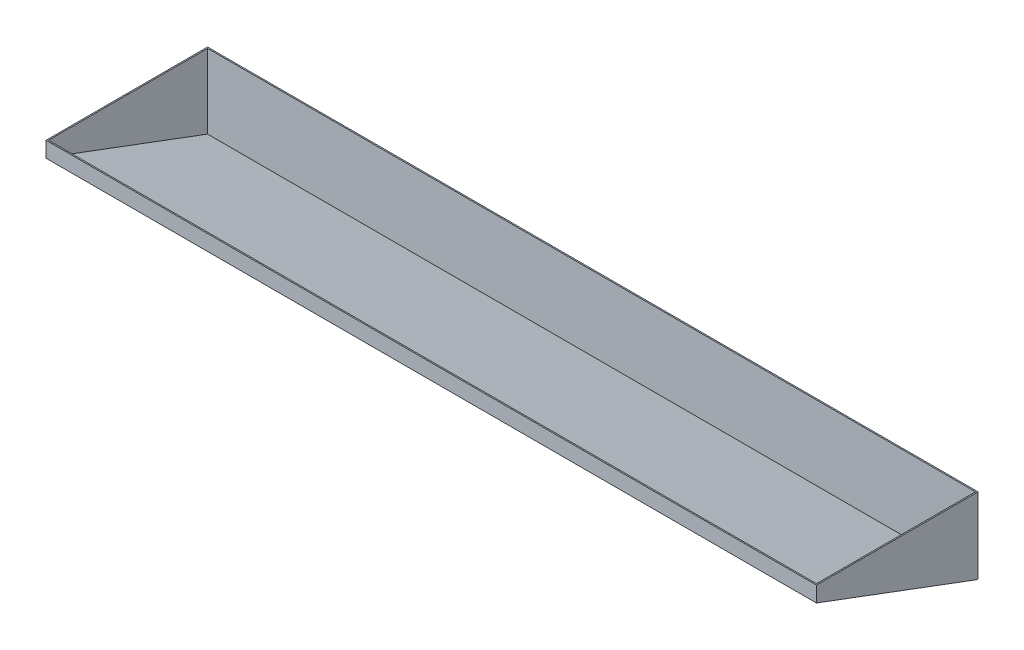
from build123d import *

# Parameters (mm, degrees)
SKETCH1_W           = 510
SKETCH1_H           = 50
BOSS_EXTRUDE1_DEPTH = 0.8
BOSS_EXTRUDE2_DEPTH = 510
SHELL3_T            = -0.8


with BuildPart() as part:
    # Sketch1 → Boss-Extrude1 (new body)
    with BuildSketch(Plane.XY):
        with Locations((255, 25)):
            Rectangle(SKETCH1_W, SKETCH1_H)
    extrude(amount=BOSS_EXTRUDE1_DEPTH)

    # Sketch3 → Boss-Extrude2 (add)
    with BuildSketch(Plane.ZY):
        Polygon((0.8, 0), (106.948846413, 39.715428922), (106.948846413, 50), (90.052783597, 50), (89.601213207, 50), (74.506616927, 50), (0.8, 50), align=None)
    extrude(amount=-BOSS_EXTRUDE2_DEPTH)

    # Shell3
    shell3_openings = [part.faces().sort_by_distance(p)[0] for p in [
        (255, 50, 53.474423206),
    ]]
    offset(amount=SHELL3_T, openings=shell3_openings, kind=Kind.INTERSECTION)


solid = part.part
